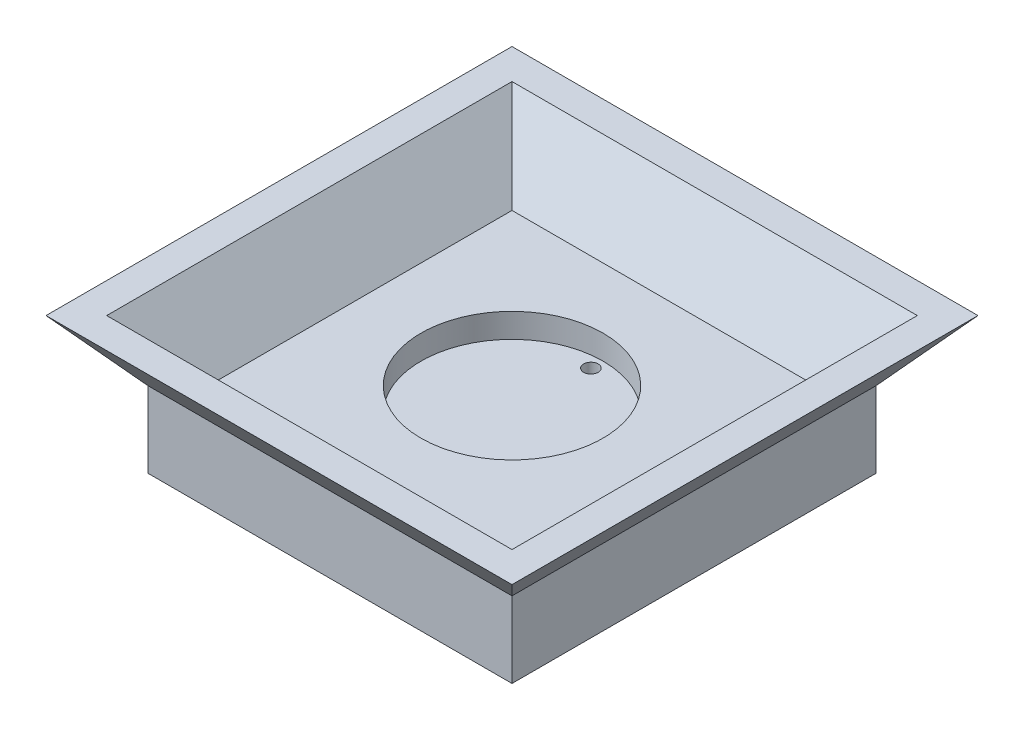
from build123d import *

# Parameters (mm, degrees)
SKETCH1_W               = 76.2
SKETCH1_H               = 76.2
BOSS_EXTRUDE1_DEPTH     = 15.875
SKETCH2_W               = 76.2
SKETCH2_H               = 76.2
BOSS_EXTRUDE2_DEPTH     = 12.7
BOSS_EXTRUDE2_DRAFT     = -40
MIRROR1_COPY_1_SKETCH_W = 76.2
MIRROR1_COPY_1_SKETCH_H = 76.2
MIRROR1_COPY_1_DEPTH    = 12.7
MIRROR1_COPY_1_DRAFT    = -40
SKETCH4_W               = 84.813130632
SKETCH4_H               = 84.813130632
CUT_EXTRUDE2_DEPTH      = 12.7
CUT_EXTRUDE2_DRAFT      = -40
SKETCH5_R               = 19.05
CUT_EXTRUDE3_DEPTH      = 5.08
SKETCH6_R               = 1.524
CUT_EXTRUDE4_DEPTH      = 20.32
CUT_EXTRUDE5_REACH      = 76.639
SKETCH8_W               = 110.353971767
SKETCH8_H               = 106.914185114


with BuildPart() as part:
    # Sketch1 → Boss-Extrude1 (new, symmetric)
    with BuildSketch(Plane(origin=(0, 0, 0), x_dir=(1, 0, 0), z_dir=(0, 1, 0))):
        Rectangle(SKETCH1_W, SKETCH1_H)
    extrude(amount=BOSS_EXTRUDE1_DEPTH, both=True)


with BuildPart() as boss_extrude2_tool:
    # Sketch2 → Boss-Extrude2 (with draft: the straight prism first)
    with BuildSketch(Plane(origin=(0, 15.875, 0), x_dir=(1, 0, 0), z_dir=(0, 1, 0))):
        Rectangle(SKETCH2_W, SKETCH2_H)
    extrude(amount=BOSS_EXTRUDE2_DEPTH)
    # Boss-Extrude2: the draft: its side faces are tilted about the plane it starts from
    boss_extrude2_sides = [boss_extrude2_tool.faces().sort_by_distance(p)[0] for p in [
        (-38.1, 22.225, 0),
        (0, 22.225, 38.1),
        (38.1, 22.225, 0),
        (0, 22.225, -38.1),
    ]]
    draft(boss_extrude2_sides, Plane(origin=(0, 15.875, 0), x_dir=(1, 0, 0), z_dir=(0, 1, 0)), BOSS_EXTRUDE2_DRAFT)


with BuildPart() as part_1:
    add(part.part)

    # Boss-Extrude2: add boss_extrude2_tool
    add(boss_extrude2_tool.part)


with BuildPart() as mirror1_copy_1_tool:
    # Mirror1 copy 1 sketch → Mirror1 copy 1 (with draft: the straight prism first)
    with BuildSketch(Plane.XZ.offset(15.875)):
        Rectangle(MIRROR1_COPY_1_SKETCH_W, MIRROR1_COPY_1_SKETCH_H)
    extrude(amount=MIRROR1_COPY_1_DEPTH)
    # Mirror1 copy 1: the draft: its side faces are tilted about the plane it starts from
    mirror1_copy_1_sides = [mirror1_copy_1_tool.faces().sort_by_distance(p)[0] for p in [
        (-38.1, -22.225, 0),
        (0, -22.225, 38.1),
        (38.1, -22.225, 0),
        (0, -22.225, -38.1),
    ]]
    draft(mirror1_copy_1_sides, Plane.XZ.offset(15.875), MIRROR1_COPY_1_DRAFT)


with BuildPart() as part_2:
    add(part_1.part)

    # Mirror1 copy 1: add mirror1_copy_1_tool
    add(mirror1_copy_1_tool.part)


with BuildPart() as cut_extrude2_tool:
    # Sketch4 → Cut-Extrude2 (with draft: the straight prism first)
    with BuildSketch(Plane(origin=(0, 28.575, 0), x_dir=(1, 0, 0), z_dir=(0, 1, 0))):
        Rectangle(SKETCH4_W, SKETCH4_H)
    extrude(amount=-CUT_EXTRUDE2_DEPTH)
    # Cut-Extrude2: the draft: its side faces are tilted about the plane it starts from
    cut_extrude2_sides = [cut_extrude2_tool.faces().sort_by_distance(p)[0] for p in [
        (42.406565316, 22.225, 0),
        (0, 22.225, -42.406565316),
        (-42.406565316, 22.225, 0),
        (0, 22.225, 42.406565316),
    ]]
    draft(cut_extrude2_sides, Plane(origin=(0, 28.575, 0), x_dir=(1, 0, 0), z_dir=(0, 1, 0)), CUT_EXTRUDE2_DRAFT)


with BuildPart() as part_3:
    add(part_2.part)

    # Cut-Extrude2: cut by cut_extrude2_tool
    add(cut_extrude2_tool.part, mode=Mode.SUBTRACT)

    # Sketch5 → Cut-Extrude3 (cut)
    with BuildSketch(Plane(origin=(0, 15.875, 0), x_dir=(1, 0, 0), z_dir=(0, 1, 0))):
        with Locations(Location((0, 0, 0), (0, 0, 270))):
            Circle(SKETCH5_R)
    extrude(amount=-CUT_EXTRUDE3_DEPTH, mode=Mode.SUBTRACT)

    # Sketch6 → Cut-Extrude4 (cut)
    with BuildSketch(Plane(origin=(0, 10.795, 0), x_dir=(1, 0, 0), z_dir=(0, 1, 0))):
        with Locations(Location((0, 16.51, 0), (0, 0, 270))):
            Circle(SKETCH6_R)
    extrude(amount=-CUT_EXTRUDE4_DEPTH, mode=Mode.SUBTRACT)

    # Sketch8 → Cut-Extrude5 (cut, up to next)
    with BuildSketch(Plane(origin=(0, 0, 0), x_dir=(1, 0, 0), z_dir=(0, 1, 0)), mode=Mode.PRIVATE) as cut_extrude5_sk1:
        with Locations((3.158987741, -3.05368815)):
            Rectangle(SKETCH8_W, SKETCH8_H)
    cut_extrude5_tool1 = extrude(cut_extrude5_sk1.sketch, amount=-CUT_EXTRUDE5_REACH, mode=Mode.PRIVATE) & part_3.part
    add(cut_extrude5_tool1.solids().sort_by_distance((3.158988, 0, 3.053688))[0], mode=Mode.SUBTRACT)


solid = part_3.part
